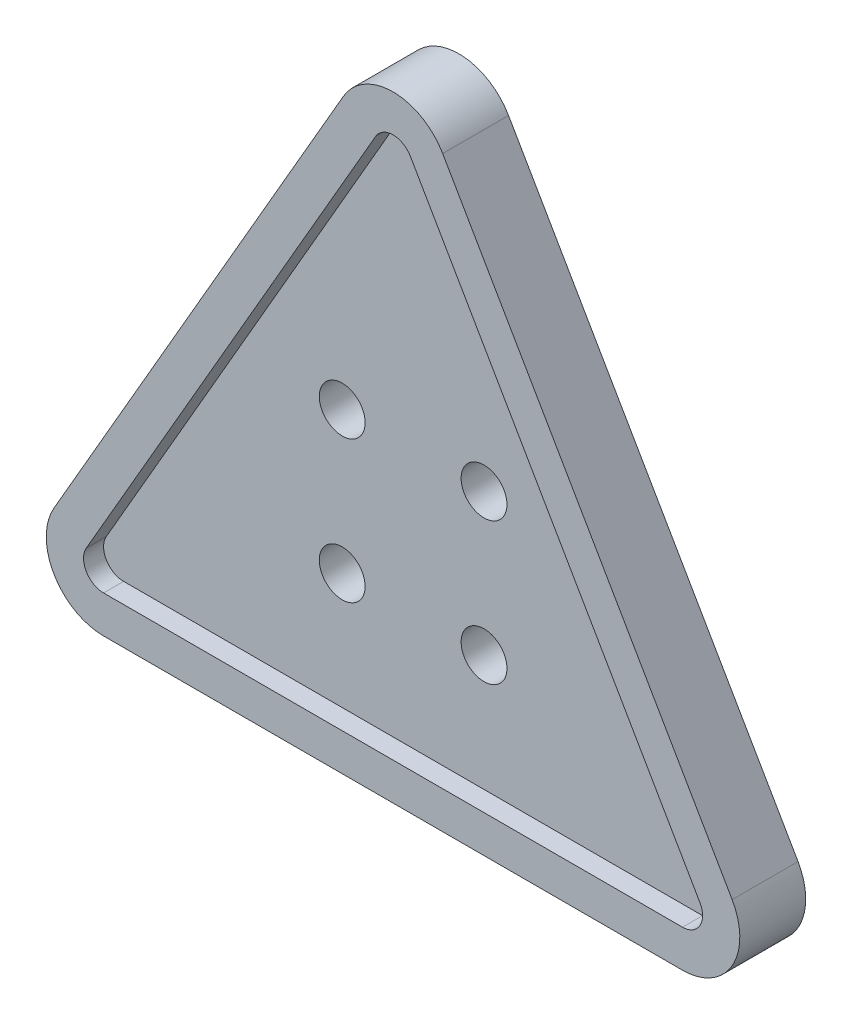
from build123d import *

# Parameters (mm, degrees)
SKETCH1_R           = 1.6
BOSS_EXTRUDE1_DEPTH = 4.6
CUT_EXTRUDE3_DEPTH  = 1.4


with BuildPart() as part:
    # Sketch1 → Boss-Extrude1 (new body)
    with BuildSketch(Plane.XY):
        with BuildLine():
            Line((-3.464101615, 25.333333333), (-23.671361037, -9.666666667))
            ThreePointArc((-23.671361037, -9.666666667), (-23.671361037, -13.666666667), (-20.207259422, -15.666666667))
            Line((-20.207259422, -15.666666667), (20.207259422, -15.666666667))
            ThreePointArc((20.207259422, -15.666666667), (23.671361037, -13.666666667), (23.671361037, -9.666666667))
            Line((23.671361037, -9.666666667), (3.464101615, 25.333333333))
            ThreePointArc((3.464101615, 25.333333333), (0, 27.333333333), (-3.464101615, 25.333333333))
        make_face()
        with Locations((-4.949747468, 4.949747468)):
            Circle(SKETCH1_R, mode=Mode.SUBTRACT)
        with Locations((4.949747468, 4.949747468)):
            Circle(SKETCH1_R, mode=Mode.SUBTRACT)
        with Locations((4.949747468, -4.949747468)):
            Circle(SKETCH1_R, mode=Mode.SUBTRACT)
        with Locations((-4.949747468, -4.949747468)):
            Circle(SKETCH1_R, mode=Mode.SUBTRACT)
    extrude(amount=BOSS_EXTRUDE1_DEPTH)

    # Sketch4 → Cut-Extrude3 (cut)
    with BuildSketch(Plane.XY.offset(4.6)):
        with BuildLine():
            Line((-20.207259422, -13.066666667), (20.207259422, -13.066666667))
            ThreePointArc((20.207259422, -13.066666667), (21.419694987, -12.366666667), (21.419694987, -10.966666667))
            Line((21.419694987, -10.966666667), (1.212435565, 24.033333333))
            ThreePointArc((1.212435565, 24.033333333), (0, 24.733333333), (-1.212435565, 24.033333333))
            Line((-1.212435565, 24.033333333), (-21.419694987, -10.966666667))
            ThreePointArc((-21.419694987, -10.966666667), (-21.419694987, -12.366666667), (-20.207259422, -13.066666667))
        make_face()
    extrude(amount=-CUT_EXTRUDE3_DEPTH, mode=Mode.SUBTRACT)


solid = part.part
